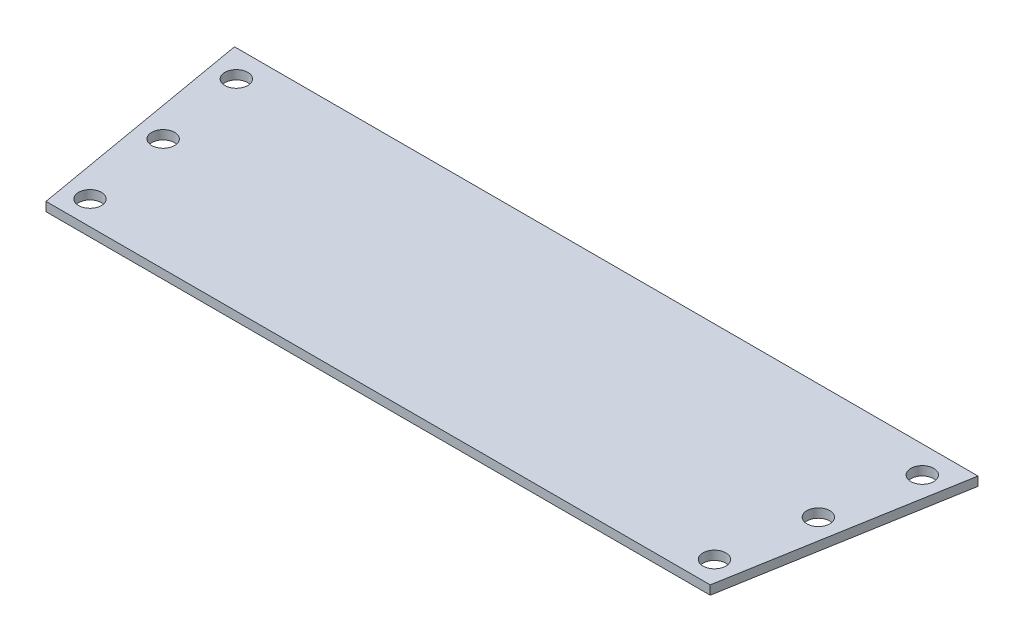
from build123d import *

# Parameters (mm, degrees)
SKETCH_1_W          = 200
SKETCH_1_H          = 60
EXTRUDE_1_DEPTH     = 2
SKETCH_3_R          = 2.55
CUT_EXTRUDE_1_DEPTH = 105.422219858
CUT_EXTRUDE_2_DEPTH = 96.828733232


with BuildPart() as part:
    # 草图1 → 凸台-拉伸1 (new body)
    with BuildSketch(Plane(origin=(0, 0, 0), x_dir=(1, 0, 0), z_dir=(0, 1, 0))):
        Rectangle(SKETCH_1_W, SKETCH_1_H)
    extrude(amount=EXTRUDE_1_DEPTH)

    # 草图3 → 切除-拉伸1 (cut, through all)
    with BuildSketch(Plane(origin=(0, 2, 0), x_dir=(1, 0, 0), z_dir=(0, 1, 0))):
        Polygon((82.173464202, -20.771330594), (-77.826535798, -20.771330594), (-86.642884834, 30), (-100, 30), (-100, -30), (100, -30), (100, 30), (90.989813237, 30), align=None)
        with Locations(Location((-74.153372817, 24, 0), (0, 0, 270))):
            Circle(SKETCH_3_R)
        with Locations(Location((-70.731615422, 4.294884514, 0), (0, 0, 270))):
            Circle(SKETCH_3_R)
        with Locations(Location((-67.309858027, -15.410230973, 0), (0, 0, 270))):
            Circle(SKETCH_3_R)
        with Locations(Location((78.50030122, 24, 0), (0, 0, 270))):
            Circle(SKETCH_3_R)
        with Locations(Location((71.65678643, -15.410230973, 0), (0, 0, 270))):
            Circle(SKETCH_3_R)
        with Locations(Location((75.078543825, 4.294884514, 0), (0, 0, 270))):
            Circle(SKETCH_3_R)
    extrude(amount=-CUT_EXTRUDE_1_DEPTH, mode=Mode.SUBTRACT)

    # 草图4 → 切除-拉伸2 (cut, through all)
    with BuildSketch(Plane.XZ):
        Polygon((76.083674975, 20.771330594), (84.90002401, -30), (90.989813237, -30), (82.173464202, 20.771330594), align=None)
        Polygon((-86.642884834, -30), (-80.553095607, -30), (-71.736746572, 20.771330594), (-77.826535798, 20.771330594), align=None)
    extrude(amount=-CUT_EXTRUDE_2_DEPTH, mode=Mode.SUBTRACT)


solid = part.part
